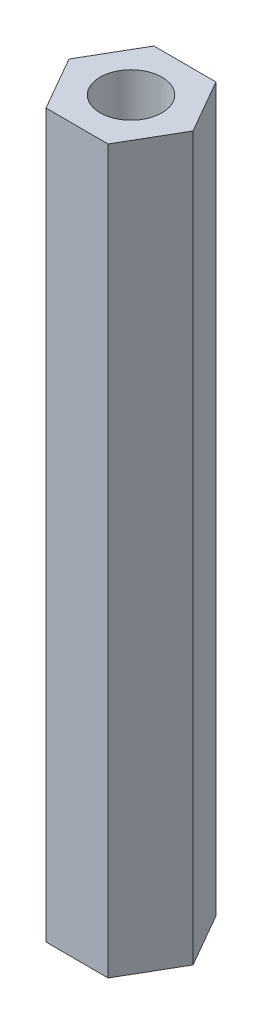
from build123d import *

# Parameters (mm, degrees)
SKETCH1_R           = 1.5
BOSS_EXTRUDE1_DEPTH = 35


with BuildPart() as part:
    # Sketch1 → Boss-Extrude1 (new body)
    with BuildSketch(Plane(origin=(0, 0, 0), x_dir=(1, 0, 0), z_dir=(0, 1, 0))):
        Polygon((1.5, -2.611820524), (3.011902924, -0.006872157), (1.511902924, 2.604948368), (-1.5, 2.611820524), (-3.011902924, 0.006872157), (-1.511902924, -2.604948368), align=None)
        Circle(SKETCH1_R, mode=Mode.SUBTRACT)
    extrude(amount=BOSS_EXTRUDE1_DEPTH)


solid = part.part
